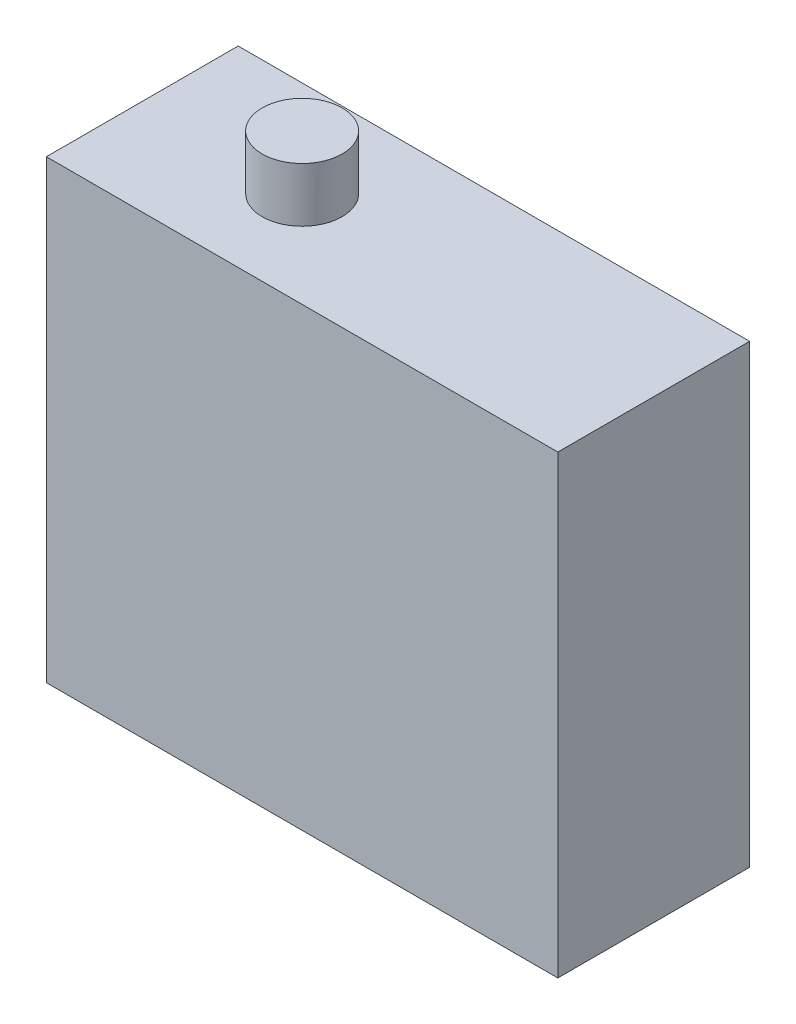
from build123d import *

# Parameters (mm, degrees)
SKETCH_1_W      = 32
SKETCH_1_H      = 28.5
EXTRUDE_1_DEPTH = 12
SKETCH_2_R      = 2.5
EXTRUDE_2_DEPTH = 3.4


with BuildPart() as part:
    # 草图1 → 凸台-拉伸1 (new body)
    with BuildSketch(Plane.XY):
        with Locations((16, 14.25)):
            Rectangle(SKETCH_1_W, SKETCH_1_H)
    extrude(amount=EXTRUDE_1_DEPTH)

    # 草图2 → 凸台-拉伸2 (add)
    with BuildSketch(Plane(origin=(0, 28.5, 0), x_dir=(1, 0, 0), z_dir=(0, 1, 0))):
        with Locations(Location((10.003220269, -6, 0), (0, 0, 90))):
            Circle(SKETCH_2_R)
    extrude(amount=EXTRUDE_2_DEPTH)


solid = part.part
